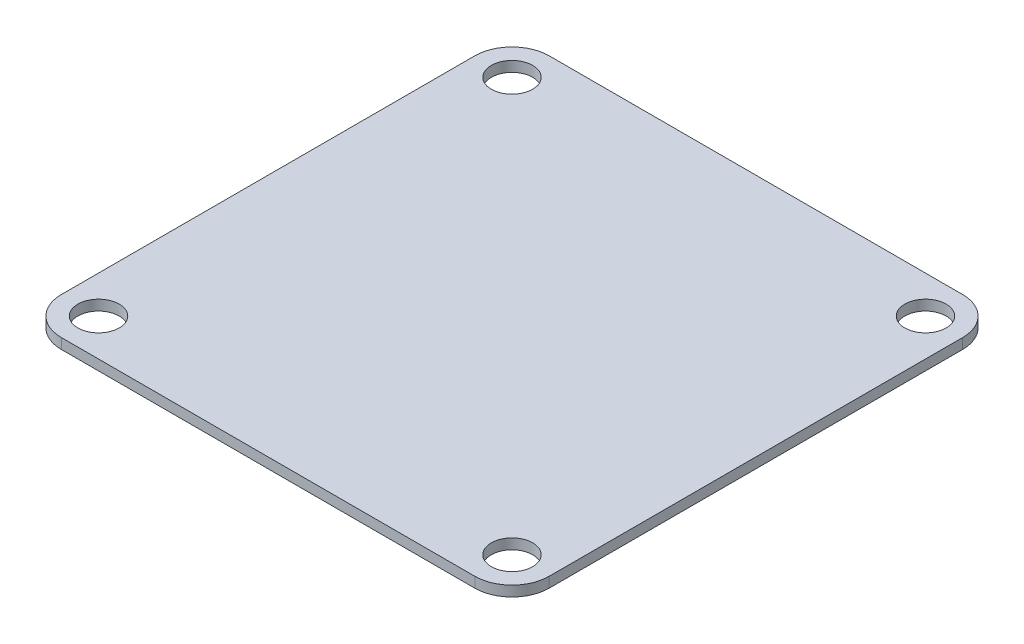
from build123d import *

# Parameters (mm, degrees)
SKETCH_1_R      = 10
EXTRUDE_1_DEPTH = 5


with BuildPart() as part:
    # 草图1 → 凸台-拉伸1 (new body)
    with BuildSketch(Plane(origin=(0, 0, 0), x_dir=(1, 0, 0), z_dir=(0, 1, 0))):
        with BuildLine():
            Line((-100, 118), (100, 118))
            ThreePointArc((100, 118), (112.727922061, 112.727922061), (118, 100))
            Line((118, 100), (118, -100))
            ThreePointArc((118, -100), (112.727922061, -112.727922061), (100, -118))
            Line((100, -118), (-100, -118))
            ThreePointArc((-100, -118), (-112.727922061, -112.727922061), (-118, -100))
            Line((-118, -100), (-118, 100))
            ThreePointArc((-118, 100), (-112.727922061, 112.727922061), (-100, 118))
        make_face()
        with Locations(Location((100, 100, 0), (0, 0, 270))):
            Circle(SKETCH_1_R, mode=Mode.SUBTRACT)
        with Locations(Location((100, -100, 0), (0, 0, 270))):
            Circle(SKETCH_1_R, mode=Mode.SUBTRACT)
        with Locations(Location((-100, -100, 0), (0, 0, 270))):
            Circle(SKETCH_1_R, mode=Mode.SUBTRACT)
        with Locations(Location((-100, 100, 0), (0, 0, 270))):
            Circle(SKETCH_1_R, mode=Mode.SUBTRACT)
    extrude(amount=EXTRUDE_1_DEPTH)


solid = part.part
